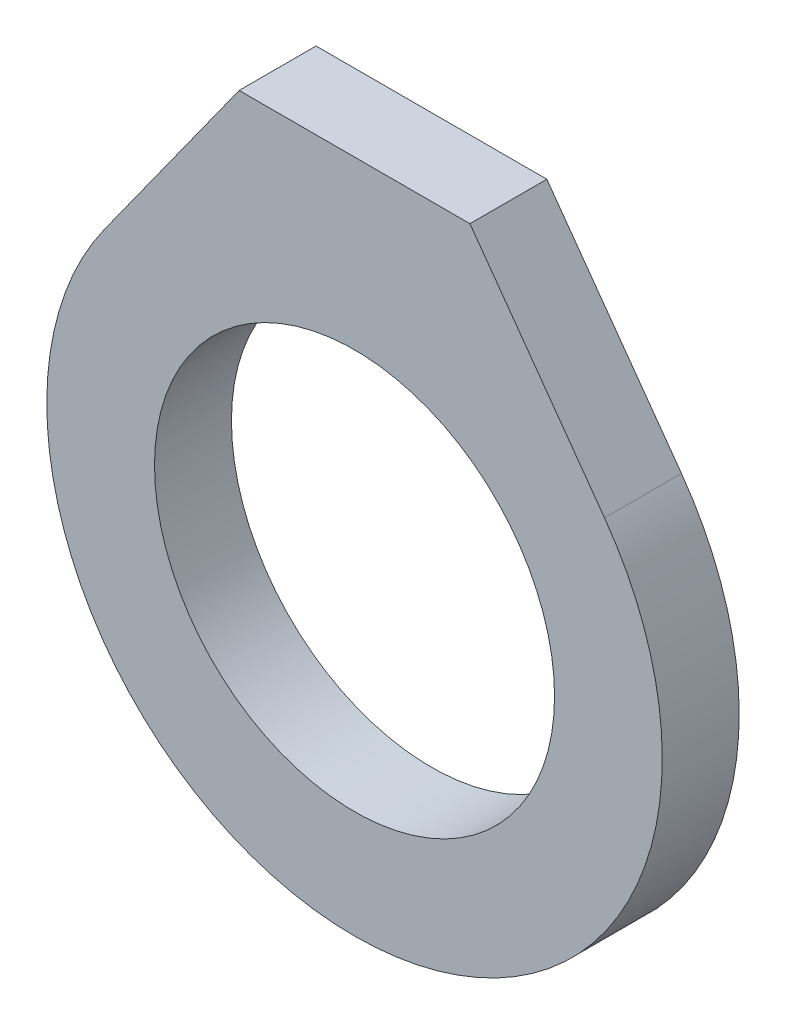
from build123d import *

# Parameters (mm, degrees)
SKETCH1_R           = 26
BOSS_EXTRUDE1_DEPTH = 5


with BuildPart() as part:
    # Sketch1 → Boss-Extrude1 (new, symmetric)
    with BuildSketch(Plane.XY):
        with BuildLine():
            Line((-32.494540834, 23.326054445), (-15, 47.696960071))
            Line((-15, 47.696960071), (15, 47.696960071))
            Line((15, 47.696960071), (32.494540834, 23.326054445))
            ThreePointArc((32.494540834, 23.326054445), (0, -40), (-32.494540834, 23.326054445))
        make_face()
        Circle(SKETCH1_R, mode=Mode.SUBTRACT)
    extrude(amount=BOSS_EXTRUDE1_DEPTH, both=True)


solid = part.part
